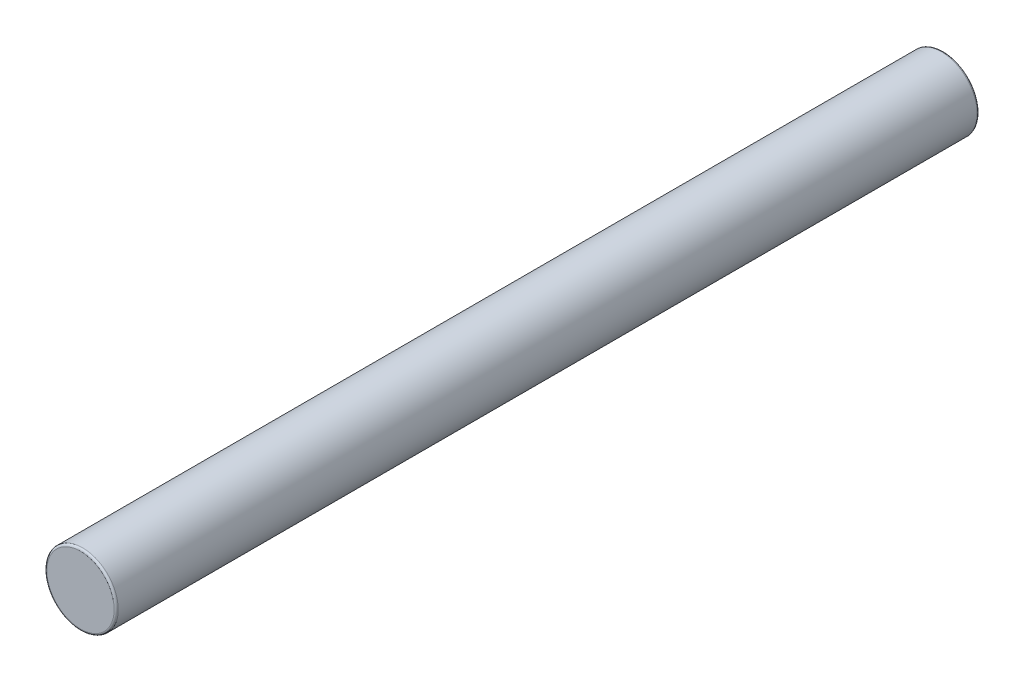
from build123d import *

# Parameters (mm, degrees)
SKETCH1_R           = 3.475
BOSS_EXTRUDE1_DEPTH = 42
FILLET1_R           = 0.2


with BuildPart() as part:
    # Sketch1 → Boss-Extrude1 (new, symmetric)
    with BuildSketch(Plane.XY):
        with Locations(Location((0, 0, 0), (0, 0, 180))):
            Circle(SKETCH1_R)
    extrude(amount=BOSS_EXTRUDE1_DEPTH, both=True)

    # Fillet1
    fillet1_edges = [part.edges().sort_by_distance(p)[0] for p in [
        (3.475, 0, -42),
        (3.475, 0, 42),
    ]]
    fillet(fillet1_edges, radius=FILLET1_R)


solid = part.part
